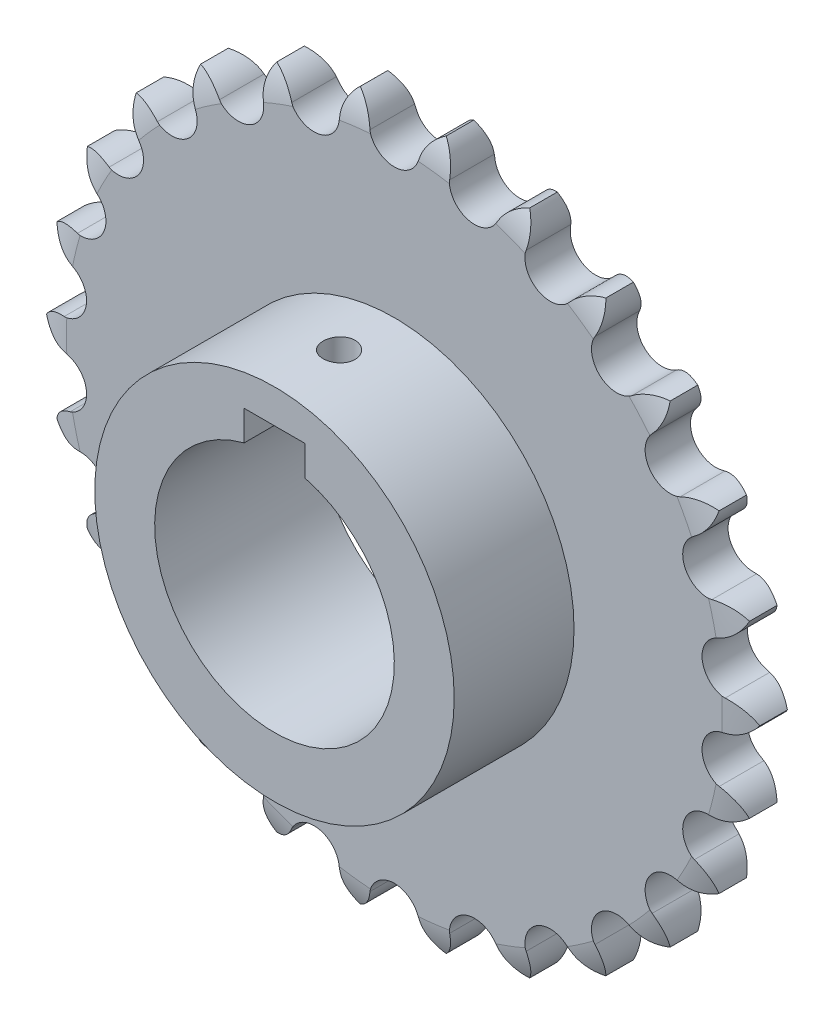
from build123d import *
from build123d.topology import SkipClean

# Parameters (mm, degrees)
BOSS_EXTRUDE2_DEPTH = 7.2136
SKETCH3_R           = 28.575
SKETCH3_R_2         = 19.05
BOSS_EXTRUDE3_DEPTH = 19.05
CUT_EXTRUDE1_START  = -32.258
CUT_EXTRUDE1_DEPTH  = 32.258
CUT_EXTRUDE2_DEPTH  = 8.636


with BuildPart() as part:
    # Sketch2 → Boss-Extrude2 (new body)
    with BuildSketch(Plane.XY):
        with BuildLine():
            ThreePointArc((3.925275227, 52.445525183), (2.510657747, 50.192863446), (0, 49.3141))
            ThreePointArc((0, 49.3141), (-2.510657747, 50.192863446), (-3.925275227, 52.445525183))
            ThreePointArc((-3.925275227, 52.445525183), (-4.966039325, 54.677124316), (-6.833832266, 56.281672267))
            ThreePointArc((-6.833832266, 56.281672267), (-8.26335708, 54.276757455), (-8.739821835, 51.860933385))
            ThreePointArc((-8.739821835, 51.860933385), (-11.8016366, 47.881121879), (-16.362249561, 49.982173688))
            ThreePointArc((-16.362249561, 49.982173688), (-17.906827574, 51.899855455), (-20.104339306, 53.01078605))
            ThreePointArc((-20.104339306, 53.01078605), (-21.012517207, 50.722022738), (-20.89699222, 48.262372646))
            ThreePointArc((-20.89699222, 48.262372646), (-22.917404978, 43.665466995), (-27.848309425, 44.614039937))
            ThreePointArc((-27.848309425, 44.614039937), (-29.806936094, 46.106355643), (-32.206455222, 46.659105635))
            ThreePointArc((-32.206455222, 46.659105635), (-32.540506211, 44.219508427), (-31.839705375, 41.858978236))
            ThreePointArc((-31.839705375, 41.858978236), (-32.701297081, 36.912133886), (-37.715926769, 36.65310035))
            ThreePointArc((-37.715926769, 36.65310035), (-39.974773832, 37.633322032), (-42.436849026, 37.595767599))
            ThreePointArc((-42.436849026, 37.595767599), (-42.177359274, 35.147117018), (-40.932010586, 33.022892161))
            ThreePointArc((-40.932010586, 33.022892161), (-40.584708661, 28.013601727), (-45.391631542, 26.562015799))
            ThreePointArc((-45.391631542, 26.562015799), (-47.819423017, 26.973176535), (-50.200967416, 26.347500205))
            ThreePointArc((-50.200967416, 26.347500205), (-49.363017525, 24.032102922), (-47.645496123, 22.267635628))
            ThreePointArc((-47.645496123, 22.267635628), (-46.109484493, 17.48702086), (-50.429339681, 14.927243439))
            ThreePointArc((-50.429339681, 14.927243439), (-52.884981153, 14.745448061), (-55.047588054, 13.568011869))
            ThreePointArc((-55.047588054, 13.568011869), (-53.679876624, 11.520430358), (-51.589998611, 10.218265051))
            ThreePointArc((-51.589998611, 10.218265051), (-48.954544688, 5.944157904), (-52.536277901, 2.424953948))
            ThreePointArc((-52.536277901, 2.424953948), (-54.877056413, 1.660767744), (-56.695042963, 0))
            ThreePointArc((-56.695042963, 0), (-54.877056413, -1.660767744), (-52.536277901, -2.424953948))
            ThreePointArc((-52.536277901, -2.424953948), (-48.954544688, -5.944157904), (-51.589998611, -10.218265051))
            ThreePointArc((-51.589998611, -10.218265051), (-53.679876624, -11.520430358), (-55.047588054, -13.568011869))
            ThreePointArc((-55.047588054, -13.568011869), (-52.884981153, -14.745448061), (-50.429339681, -14.927243439))
            ThreePointArc((-50.429339681, -14.927243439), (-46.109484493, -17.48702086), (-47.645496123, -22.267635628))
            ThreePointArc((-47.645496123, -22.267635628), (-49.363017525, -24.032102922), (-50.200967416, -26.347500205))
            ThreePointArc((-50.200967416, -26.347500205), (-47.819423017, -26.973176535), (-45.391631542, -26.562015799))
            ThreePointArc((-45.391631542, -26.562015799), (-40.584708661, -28.013601727), (-40.932010586, -33.022892161))
            ThreePointArc((-40.932010586, -33.022892161), (-42.177359274, -35.147117018), (-42.436849026, -37.595767599))
            ThreePointArc((-42.436849026, -37.595767599), (-39.974773832, -37.633322032), (-37.715926769, -36.65310035))
            ThreePointArc((-37.715926769, -36.65310035), (-32.701297081, -36.912133886), (-31.839705375, -41.858978236))
            ThreePointArc((-31.839705375, -41.858978236), (-32.540506211, -44.219508427), (-32.206455222, -46.659105635))
            ThreePointArc((-32.206455222, -46.659105635), (-29.806936094, -46.106355643), (-27.848309425, -44.614039937))
            ThreePointArc((-27.848309425, -44.614039937), (-22.917404978, -43.665466995), (-20.89699222, -48.262372646))
            ThreePointArc((-20.89699222, -48.262372646), (-21.012517207, -50.722022738), (-20.104339306, -53.01078605))
            ThreePointArc((-20.104339306, -53.01078605), (-17.906827574, -51.899855455), (-16.362249561, -49.982173688))
            ThreePointArc((-16.362249561, -49.982173688), (-11.8016366, -47.881121879), (-8.739821835, -51.860933385))
            ThreePointArc((-8.739821835, -51.860933385), (-8.26335708, -54.276757455), (-6.833832266, -56.281672267))
            ThreePointArc((-6.833832266, -56.281672267), (-4.966039325, -54.677124316), (-3.925275227, -52.445525183))
            ThreePointArc((-3.925275227, -52.445525183), (0, -49.3141), (3.925275227, -52.445525183))
            ThreePointArc((3.925275227, -52.445525183), (4.966039325, -54.677124316), (6.833832266, -56.281672267))
            ThreePointArc((6.833832266, -56.281672267), (8.26335708, -54.276757455), (8.739821835, -51.860933385))
            ThreePointArc((8.739821835, -51.860933385), (11.8016366, -47.881121879), (16.362249561, -49.982173688))
            ThreePointArc((16.362249561, -49.982173688), (17.906827574, -51.899855455), (20.104339306, -53.01078605))
            ThreePointArc((20.104339306, -53.01078605), (21.012517207, -50.722022738), (20.89699222, -48.262372646))
            ThreePointArc((20.89699222, -48.262372646), (22.917404978, -43.665466995), (27.848309425, -44.614039937))
            ThreePointArc((27.848309425, -44.614039937), (29.806936094, -46.106355643), (32.206455222, -46.659105635))
            ThreePointArc((32.206455222, -46.659105635), (32.540506211, -44.219508427), (31.839705375, -41.858978236))
            ThreePointArc((31.839705375, -41.858978236), (32.701297081, -36.912133886), (37.715926769, -36.65310035))
            ThreePointArc((37.715926769, -36.65310035), (39.974773832, -37.633322032), (42.436849026, -37.595767599))
            ThreePointArc((42.436849026, -37.595767599), (42.177359274, -35.147117018), (40.932010586, -33.022892161))
            ThreePointArc((40.932010586, -33.022892161), (40.584708661, -28.013601727), (45.391631542, -26.562015799))
            ThreePointArc((45.391631542, -26.562015799), (47.819423017, -26.973176535), (50.200967416, -26.347500205))
            ThreePointArc((50.200967416, -26.347500205), (49.363017525, -24.032102922), (47.645496123, -22.267635628))
            ThreePointArc((47.645496123, -22.267635628), (46.109484493, -17.48702086), (50.429339681, -14.927243439))
            ThreePointArc((50.429339681, -14.927243439), (52.884981153, -14.745448061), (55.047588054, -13.568011869))
            ThreePointArc((55.047588054, -13.568011869), (53.679876624, -11.520430358), (51.589998611, -10.218265051))
            ThreePointArc((51.589998611, -10.218265051), (48.954544688, -5.944157904), (52.536277901, -2.424953948))
            ThreePointArc((52.536277901, -2.424953948), (54.877056413, -1.660767744), (56.695042963, 0))
            ThreePointArc((56.695042963, 0), (54.877056413, 1.660767744), (52.536277901, 2.424953948))
            ThreePointArc((52.536277901, 2.424953948), (48.954544688, 5.944157904), (51.589998611, 10.218265051))
            ThreePointArc((51.589998611, 10.218265051), (53.679876624, 11.520430358), (55.047588054, 13.568011869))
            ThreePointArc((55.047588054, 13.568011869), (52.884981153, 14.745448061), (50.429339681, 14.927243439))
            ThreePointArc((50.429339681, 14.927243439), (46.109484493, 17.48702086), (47.645496123, 22.267635628))
            ThreePointArc((47.645496123, 22.267635628), (49.363017525, 24.032102922), (50.200967416, 26.347500205))
            ThreePointArc((50.200967416, 26.347500205), (47.819423017, 26.973176535), (45.391631542, 26.562015799))
            ThreePointArc((45.391631542, 26.562015799), (40.584708661, 28.013601727), (40.932010586, 33.022892161))
            ThreePointArc((40.932010586, 33.022892161), (42.177359274, 35.147117018), (42.436849026, 37.595767599))
            ThreePointArc((42.436849026, 37.595767599), (39.974773832, 37.633322032), (37.715926769, 36.65310035))
            ThreePointArc((37.715926769, 36.65310035), (32.701297081, 36.912133886), (31.839705375, 41.858978236))
            ThreePointArc((31.839705375, 41.858978236), (32.540506211, 44.219508427), (32.206455222, 46.659105635))
            ThreePointArc((32.206455222, 46.659105635), (29.806936094, 46.106355643), (27.848309425, 44.614039937))
            ThreePointArc((27.848309425, 44.614039937), (22.917404978, 43.665466995), (20.89699222, 48.262372646))
            ThreePointArc((20.89699222, 48.262372646), (21.012517207, 50.722022738), (20.104339306, 53.01078605))
            ThreePointArc((20.104339306, 53.01078605), (17.906827574, 51.899855455), (16.362249561, 49.982173688))
            ThreePointArc((16.362249561, 49.982173688), (11.8016366, 47.881121879), (8.739821835, 51.860933385))
            ThreePointArc((8.739821835, 51.860933385), (8.26335708, 54.276757455), (6.833832266, 56.281672267))
            ThreePointArc((6.833832266, 56.281672267), (4.966039325, 54.677124316), (3.925275227, 52.445525183))
        make_face()
        with BuildLine():
            ThreePointArc((19.05, 0), (-13.470384182, -13.470384182), (0, 19.05))
            ThreePointArc((0, 19.05), (13.470384182, 13.470384182), (19.05, 0))
        make_face(mode=Mode.SUBTRACT)
    extrude(amount=BOSS_EXTRUDE2_DEPTH)

    # Sketch3 → Boss-Extrude3 (add)
    with SkipClean():  # the faces are left unmerged after this step: merging them gives an invalid solid
        with BuildSketch(Plane.XY.offset(7.2136)):
            with Locations(Location((0, 0, 0), (0, 0, 180))):
                Circle(SKETCH3_R)
            Circle(SKETCH3_R_2, mode=Mode.SUBTRACT)
        extrude(amount=BOSS_EXTRUDE3_DEPTH)

    # Sketch4 → Cut-Extrude1 (cut)
    with BuildSketch(Plane.XY.offset(26.2636).offset(CUT_EXTRUDE1_START)):
        with BuildLine():
            ThreePointArc((-4.826, 18.428570862), (-2.432922634, 18.894004008), (0, 19.05))
            Line((0, 19.05), (0, 23.197581612))
            Line((0, 23.197581612), (-4.826, 23.197581612))
            Line((-4.826, 23.197581612), (-4.826, 18.428570862))
        make_face()
        with BuildLine():
            Line((0, 23.197581612), (0, 19.05))
            ThreePointArc((0, 19.05), (2.432922634, 18.894004008), (4.826, 18.428570862))
            Line((4.826, 18.428570862), (4.826, 23.197581612))
            Line((4.826, 23.197581612), (0, 23.197581612))
        make_face()
    extrude(amount=CUT_EXTRUDE1_DEPTH, mode=Mode.SUBTRACT)

    # Sketch5 → Cut-Extrude2 (cut)
    with BuildSketch(Plane.XZ.offset(-23.197581612)):
        with BuildLine():
            ThreePointArc((0, 18.542), (-2.54, 16.002), (0, 13.462))
            Line((0, 13.462), (0, 18.542))
        make_face()
        with BuildLine():
            Line((0, 18.542), (0, 13.462))
            ThreePointArc((0, 13.462), (1.796051224, 14.205948776), (2.54, 16.002))
            ThreePointArc((2.54, 16.002), (1.796051224, 17.798051224), (0, 18.542))
        make_face()
    extrude(amount=-CUT_EXTRUDE2_DEPTH, mode=Mode.SUBTRACT)

    # Sketch7 → Cut-Revolve1 (revolve, cut)
    with BuildSketch(Plane(origin=(0, 0, 0), x_dir=(0, 0, -1), z_dir=(1, 0, 0)), mode=Mode.PRIVATE) as cut_revolve1_sk:
        with BuildLine():
            Line((1.715711903, 56.896), (-1.524, 56.896))
            ThreePointArc((-1.524, 56.896), (-0.170850528, 53.223874014), (0, 49.3141))
            Line((0, 49.3141), (1.715711903, 49.3141))
            Line((1.715711903, 49.3141), (1.715711903, 56.896))
        make_face()
        with BuildLine():
            Line((-7.2136, 49.3141), (-8.929311903, 49.3141))
            Line((-8.929311903, 49.3141), (-8.929311903, 56.896))
            Line((-8.929311903, 56.896), (-5.6896, 56.896))
            ThreePointArc((-5.6896, 56.896), (-7.042749472, 53.223874014), (-7.2136, 49.3141))
        make_face()
    revolve(cut_revolve1_sk.sketch.rotate(Axis((0, 0, 0), (0, 0, 1)), 270), axis=Axis((0, 0, 0), (0, 0, 1)), mode=Mode.SUBTRACT)


solid = part.part
